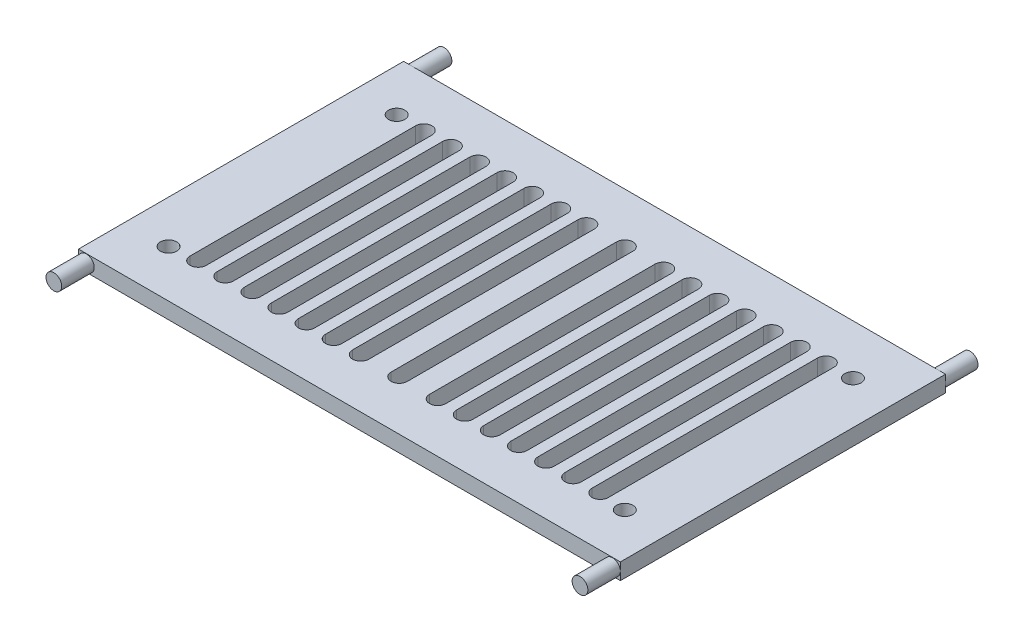
from build123d import *

# Parameters (mm, degrees)
EXTRUDE_1_DEPTH      = 55.815
EXTRUDE_1_DEPTH_BACK = 4.185
SKETCH_8_R           = 1.5
CUT_EXTRUDE_1_DEPTH  = 3
SKETCH_11_R          = 1.45
EXTRUDE_4_DEPTH      = 6
EXTRUDE_START        = 6
SKETCH_12_R          = 1.45
EXTRUDE_5_DEPTH      = 6


with BuildPart() as part:
    # 草图1 → 凸台-拉伸1 (new, two sides: drawn at the far end of the back side and taken through both)
    with BuildSketch(Plane.XY.offset(-EXTRUDE_1_DEPTH_BACK)):
        Polygon((50, 0), (50, 1.5), (30, 1.5), (0, 1.5), (-50, 1.5), (-50, -1.5), (30, -1.5), (50, -1.5), align=None)
    extrude(amount=EXTRUDE_1_DEPTH + EXTRUDE_1_DEPTH_BACK)

    # 草图8 → 切除-拉伸1 (cut)
    with BuildSketch(Plane(origin=(0, 1.5, 0), x_dir=(1, 0, 0), z_dir=(0, 1, 0))):
        with BuildLine():
            Line((1.5, -46.63), (1.5, -5))
            ThreePointArc((1.5, -5), (1.060660172, -3.939339828), (0, -3.5))
            ThreePointArc((0, -3.5), (-1.060660172, -3.939339828), (-1.5, -5))
            Line((-1.5, -5), (-1.5, -46.63))
            ThreePointArc((-1.5, -46.63), (0, -48.13), (1.5, -46.63))
        make_face()
        with BuildLine():
            ThreePointArc((-35.6, -5), (-37.1, -3.5), (-38.6, -5))
            Line((-38.6, -5), (-38.6, -46.63))
            ThreePointArc((-38.6, -46.63), (-37.1, -48.13), (-35.6, -46.63))
            Line((-35.6, -46.63), (-35.6, -5))
        make_face()
        with BuildLine():
            ThreePointArc((-30.6, -5), (-32.1, -3.5), (-33.6, -5))
            Line((-33.6, -5), (-33.6, -46.63))
            ThreePointArc((-33.6, -46.63), (-32.1, -48.13), (-30.6, -46.63))
            Line((-30.6, -46.63), (-30.6, -5))
        make_face()
        with BuildLine():
            ThreePointArc((-25.6, -5), (-27.1, -3.5), (-28.6, -5))
            Line((-28.6, -5), (-28.6, -46.63))
            ThreePointArc((-28.6, -46.63), (-27.1, -48.13), (-25.6, -46.63))
            Line((-25.6, -46.63), (-25.6, -5))
        make_face()
        with BuildLine():
            ThreePointArc((-20.6, -5), (-22.1, -3.5), (-23.6, -5))
            Line((-23.6, -5), (-23.6, -46.63))
            ThreePointArc((-23.6, -46.63), (-22.1, -48.13), (-20.6, -46.63))
            Line((-20.6, -46.63), (-20.6, -5))
        make_face()
        with BuildLine():
            ThreePointArc((-15.6, -5), (-17.1, -3.5), (-18.6, -5))
            Line((-18.6, -5), (-18.6, -46.63))
            ThreePointArc((-18.6, -46.63), (-17.1, -48.13), (-15.6, -46.63))
            Line((-15.6, -46.63), (-15.6, -5))
        make_face()
        with BuildLine():
            ThreePointArc((-10.6, -5), (-12.1, -3.5), (-13.6, -5))
            Line((-13.6, -5), (-13.6, -46.63))
            ThreePointArc((-13.6, -46.63), (-12.1, -48.13), (-10.6, -46.63))
            Line((-10.6, -46.63), (-10.6, -5))
        make_face()
        with BuildLine():
            ThreePointArc((-5.6, -5), (-7.1, -3.5), (-8.6, -5))
            Line((-8.6, -5), (-8.6, -46.63))
            ThreePointArc((-8.6, -46.63), (-7.1, -48.13), (-5.6, -46.63))
            Line((-5.6, -46.63), (-5.6, -5))
        make_face()
        with BuildLine():
            ThreePointArc((8.6, -5), (7.1, -3.5), (5.6, -5))
            Line((5.6, -5), (5.6, -46.63))
            ThreePointArc((5.6, -46.63), (7.1, -48.13), (8.6, -46.63))
            Line((8.6, -46.63), (8.6, -5))
        make_face()
        with BuildLine():
            ThreePointArc((13.6, -5), (12.1, -3.5), (10.6, -5))
            Line((10.6, -5), (10.6, -46.63))
            ThreePointArc((10.6, -46.63), (12.1, -48.13), (13.6, -46.63))
            Line((13.6, -46.63), (13.6, -5))
        make_face()
        with BuildLine():
            ThreePointArc((18.6, -5), (17.1, -3.5), (15.6, -5))
            Line((15.6, -5), (15.6, -46.63))
            ThreePointArc((15.6, -46.63), (17.1, -48.13), (18.6, -46.63))
            Line((18.6, -46.63), (18.6, -5))
        make_face()
        with BuildLine():
            ThreePointArc((23.6, -5), (22.1, -3.5), (20.6, -5))
            Line((20.6, -5), (20.6, -46.63))
            ThreePointArc((20.6, -46.63), (22.1, -48.13), (23.6, -46.63))
            Line((23.6, -46.63), (23.6, -5))
        make_face()
        with BuildLine():
            ThreePointArc((28.6, -5), (27.1, -3.5), (25.6, -5))
            Line((25.6, -5), (25.6, -46.63))
            ThreePointArc((25.6, -46.63), (27.1, -48.13), (28.6, -46.63))
            Line((28.6, -46.63), (28.6, -5))
        make_face()
        with BuildLine():
            ThreePointArc((33.6, -5), (32.1, -3.5), (30.6, -5))
            Line((30.6, -5), (30.6, -46.63))
            ThreePointArc((30.6, -46.63), (32.1, -48.13), (33.6, -46.63))
            Line((33.6, -46.63), (33.6, -5))
        make_face()
        with BuildLine():
            ThreePointArc((38.6, -5), (37.1, -3.5), (35.6, -5))
            Line((35.6, -5), (35.6, -46.63))
            ThreePointArc((35.6, -46.63), (37.1, -48.13), (38.6, -46.63))
            Line((38.6, -46.63), (38.6, -5))
        make_face()
        with Locations(Location((-42.1, -5, 0), (0, 0, 270))):
            Circle(SKETCH_8_R)
        with Locations(Location((-42.1, -47.1, 0), (0, 0, 270))):
            Circle(SKETCH_8_R)
        with Locations(Location((42.1, -47.1, 0), (0, 0, 270))):
            Circle(SKETCH_8_R)
        with Locations(Location((42.1, -5, 0), (0, 0, 270))):
            Circle(SKETCH_8_R)
    extrude(amount=-CUT_EXTRUDE_1_DEPTH, mode=Mode.SUBTRACT)

    # 草图11 → 凸台-拉伸4 (add)
    with BuildSketch(Plane.XY.offset(55.815)):
        with Locations(Location((-48.55, 0, 0), (0, 0, 180))):
            Circle(SKETCH_11_R)
        with Locations(Location((48.55, 0, 0), (0, 0, 180))):
            Circle(SKETCH_11_R)
    extrude(amount=EXTRUDE_4_DEPTH)

    # 草图12 → 凸台-拉伸5 (add)
    with BuildSketch(Plane(origin=(0, 0, -4.185), x_dir=(-1, 0, 0), z_dir=(0, 0, -1)).offset(EXTRUDE_START)):
        with Locations((-48.55, 0)):
            Circle(SKETCH_12_R)
        with Locations((48.55, 0)):
            Circle(SKETCH_12_R)
    extrude(amount=-EXTRUDE_5_DEPTH)


solid = part.part
